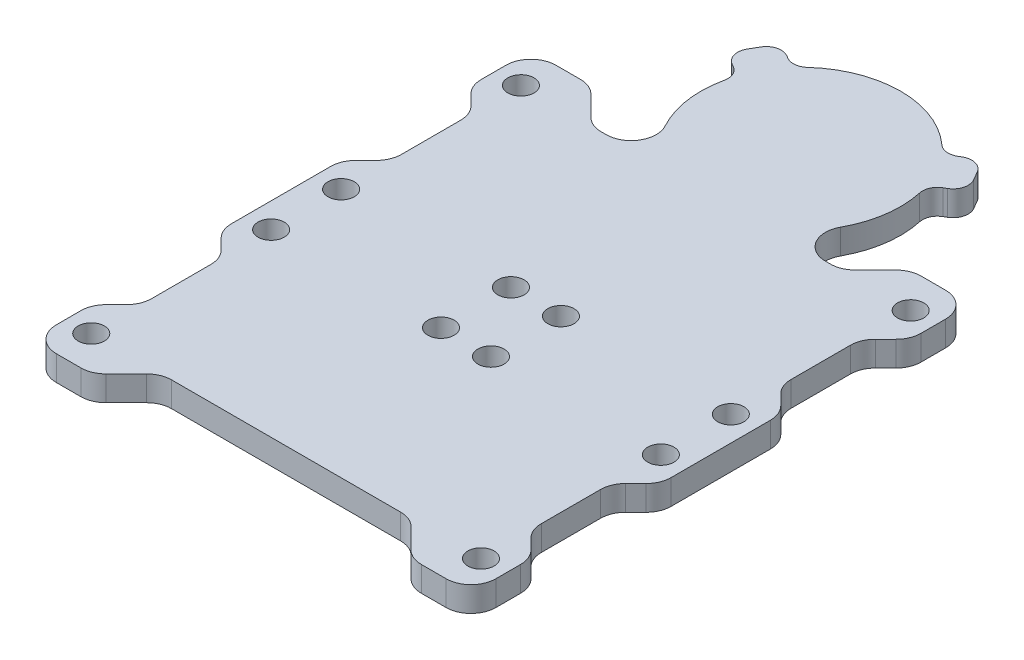
from build123d import *

# Parameters (mm, degrees)
SKETCH1_R           = 2.625
BOSS_EXTRUDE1_DEPTH = 5


with BuildPart() as part:
    # Sketch1 → Boss-Extrude1 (new body)
    with BuildSketch(Plane(origin=(0, 0, 0), x_dir=(1, 0, 0), z_dir=(0, 1, 0))):
        with BuildLine():
            Line((-42.535533906, 36.535533906), (-40.464466094, 34.464466094))
            ThreePointArc((-40.464466094, 34.464466094), (-39.380602337, 32.84234935), (-39, 30.928932188))
            Line((-39, 30.928932188), (-39, 19.071067812))
            ThreePointArc((-39, 19.071067812), (-39.380602337, 17.15765065), (-40.464466094, 15.535533906))
            Line((-40.464466094, 15.535533906), (-42.535533906, 13.464466094))
            ThreePointArc((-42.535533906, 13.464466094), (-43.619397663, 11.84234935), (-44, 9.928932188))
            Line((-44, 9.928932188), (-44, -9.928932188))
            ThreePointArc((-44, -9.928932188), (-43.619397663, -11.84234935), (-42.535533906, -13.464466094))
            Line((-42.535533906, -13.464466094), (-40.464466094, -15.535533906))
            ThreePointArc((-40.464466094, -15.535533906), (-39.380602337, -17.15765065), (-39, -19.071067812))
            Line((-39, -19.071067812), (-39, -30.928932188))
            ThreePointArc((-39, -30.928932188), (-39.380602337, -32.84234935), (-40.464466094, -34.464466094))
            Line((-40.464466094, -34.464466094), (-42.535533906, -36.535533906))
            ThreePointArc((-42.535533906, -36.535533906), (-43.619397663, -38.15765065), (-44, -40.071067812))
            Line((-44, -40.071067812), (-44, -45))
            ThreePointArc((-44, -45), (-42.535533906, -48.535533906), (-39, -50))
            Line((-39, -50), (-34.071067812, -50))
            ThreePointArc((-34.071067812, -50), (-32.15765065, -49.619397663), (-30.535533906, -48.535533906))
            Line((-30.535533906, -48.535533906), (-26.464466094, -44.464466094))
            ThreePointArc((-26.464466094, -44.464466094), (-24.84234935, -43.380602337), (-22.928932188, -43))
            Line((-22.928932188, -43), (22.928932188, -43))
            ThreePointArc((22.928932188, -43), (24.84234935, -43.380602337), (26.464466094, -44.464466094))
            Line((26.464466094, -44.464466094), (30.535533906, -48.535533906))
            ThreePointArc((30.535533906, -48.535533906), (32.15765065, -49.619397663), (34.071067812, -50))
            Line((34.071067812, -50), (39, -50))
            ThreePointArc((39, -50), (42.535533906, -48.535533906), (44, -45))
            Line((44, -45), (44, -40.071067812))
            ThreePointArc((44, -40.071067812), (43.619397663, -38.15765065), (42.535533906, -36.535533906))
            Line((42.535533906, -36.535533906), (40.464466094, -34.464466094))
            ThreePointArc((40.464466094, -34.464466094), (39.380602337, -32.84234935), (39, -30.928932188))
            Line((39, -30.928932188), (39, -19.071067812))
            ThreePointArc((39, -19.071067812), (39.380602337, -17.15765065), (40.464466094, -15.535533906))
            Line((40.464466094, -15.535533906), (42.535533906, -13.464466094))
            ThreePointArc((42.535533906, -13.464466094), (43.619397663, -11.84234935), (44, -9.928932188))
            Line((44, -9.928932188), (44, 9.928932188))
            ThreePointArc((44, 9.928932188), (43.619397663, 11.84234935), (42.535533906, 13.464466094))
            Line((42.535533906, 13.464466094), (40.464466094, 15.535533906))
            ThreePointArc((40.464466094, 15.535533906), (39.380602337, 17.15765065), (39, 19.071067812))
            Line((39, 19.071067812), (39, 30.928932188))
            ThreePointArc((39, 30.928932188), (39.380602337, 32.84234935), (40.464466094, 34.464466094))
            Line((40.464466094, 34.464466094), (42.535533906, 36.535533906))
            ThreePointArc((42.535533906, 36.535533906), (43.619397663, 38.15765065), (44, 40.071067812))
            Line((44, 40.071067812), (44, 45))
            ThreePointArc((44, 45), (42.535533906, 48.535533906), (39, 50))
            Line((39, 50), (34.071067812, 50))
            ThreePointArc((34.071067812, 50), (32.15765065, 49.619397663), (30.535533906, 48.535533906))
            Line((30.535533906, 48.535533906), (26.464466094, 44.464466094))
            ThreePointArc((26.464466094, 44.464466094), (24.84234935, 43.380602337), (22.928932188, 43))
            Line((22.928932188, 43), (21.931712199, 43))
            ThreePointArc((21.931712199, 43), (17.630549566, 45.450490243), (17.54536976, 50.4))
            ThreePointArc((17.54536976, 50.4), (19.795416719, 57.146672655), (19.542318227, 64.254150716))
            ThreePointArc((19.542318227, 64.254150716), (19.730044926, 66.105757405), (20.973665961, 67.490349535))
            Line((20.973665961, 67.490349535), (21.56863896, 67.833857356))
            ThreePointArc((21.56863896, 67.833857356), (22.966416439, 69.655476432), (22.666715171, 71.931933567))
            Line((22.666715171, 71.931933567), (21.666715171, 73.663984375))
            ThreePointArc((21.666715171, 73.663984375), (19.845096095, 75.061761854), (17.56863896, 74.762060586))
            Line((17.56863896, 74.762060586), (16.973665961, 74.418552765))
            ThreePointArc((16.973665961, 74.418552765), (15.152763485, 74.033841421), (13.455361705, 74.797068675))
            ThreePointArc((13.455361705, 74.797068675), (0, 80), (-13.455361705, 74.797068675))
            ThreePointArc((-13.455361705, 74.797068675), (-15.152763485, 74.033841421), (-16.973665961, 74.418552765))
            Line((-16.973665961, 74.418552765), (-17.56863896, 74.762060586))
            ThreePointArc((-17.56863896, 74.762060586), (-19.845096095, 75.061761854), (-21.666715171, 73.663984375))
            Line((-21.666715171, 73.663984375), (-22.666715171, 71.931933567))
            ThreePointArc((-22.666715171, 71.931933567), (-22.966416439, 69.655476432), (-21.56863896, 67.833857356))
            Line((-21.56863896, 67.833857356), (-20.973665961, 67.490349535))
            ThreePointArc((-20.973665961, 67.490349535), (-19.730044926, 66.105757405), (-19.542318227, 64.254150716))
            ThreePointArc((-19.542318227, 64.254150716), (-19.795416719, 57.146672655), (-17.54536976, 50.4))
            ThreePointArc((-17.54536976, 50.4), (-17.630549566, 45.450490243), (-21.931712199, 43))
            Line((-21.931712199, 43), (-22.928932188, 43))
            ThreePointArc((-22.928932188, 43), (-24.84234935, 43.380602337), (-26.464466094, 44.464466094))
            Line((-26.464466094, 44.464466094), (-30.535533906, 48.535533906))
            ThreePointArc((-30.535533906, 48.535533906), (-32.15765065, 49.619397663), (-34.071067812, 50))
            Line((-34.071067812, 50), (-39, 50))
            ThreePointArc((-39, 50), (-42.535533906, 48.535533906), (-44, 45))
            Line((-44, 45), (-44, 40.071067812))
            ThreePointArc((-44, 40.071067812), (-43.619397663, 38.15765065), (-42.535533906, 36.535533906))
        make_face()
        with Locations(Location((-39, 43, 0), (0, 0, 270))):
            Circle(SKETCH1_R, mode=Mode.SUBTRACT)
        with Locations(Location((-39, 7, 0), (0, 0, 270))):
            Circle(SKETCH1_R, mode=Mode.SUBTRACT)
        with Locations(Location((-39, -7, 0), (0, 0, 270))):
            Circle(SKETCH1_R, mode=Mode.SUBTRACT)
        with Locations(Location((-39, -43, 0), (0, 0, 270))):
            Circle(SKETCH1_R, mode=Mode.SUBTRACT)
        with Locations(Location((39, -43, 0), (0, 0, 270))):
            Circle(SKETCH1_R, mode=Mode.SUBTRACT)
        with Locations(Location((39, -7, 0), (0, 0, 270))):
            Circle(SKETCH1_R, mode=Mode.SUBTRACT)
        with Locations(Location((39, 7, 0), (0, 0, 270))):
            Circle(SKETCH1_R, mode=Mode.SUBTRACT)
        with Locations(Location((39, 43, 0), (0, 0, 270))):
            Circle(SKETCH1_R, mode=Mode.SUBTRACT)
        with Locations(Location((-5, 7, 0), (0, 0, 270))):
            Circle(SKETCH1_R, mode=Mode.SUBTRACT)
        with Locations(Location((5, 7, 0), (0, 0, 270))):
            Circle(SKETCH1_R, mode=Mode.SUBTRACT)
        with Locations(Location((5, -7, 0), (0, 0, 270))):
            Circle(SKETCH1_R, mode=Mode.SUBTRACT)
        with Locations(Location((-5, -7, 0), (0, 0, 270))):
            Circle(SKETCH1_R, mode=Mode.SUBTRACT)
    extrude(amount=BOSS_EXTRUDE1_DEPTH)


solid = part.part
